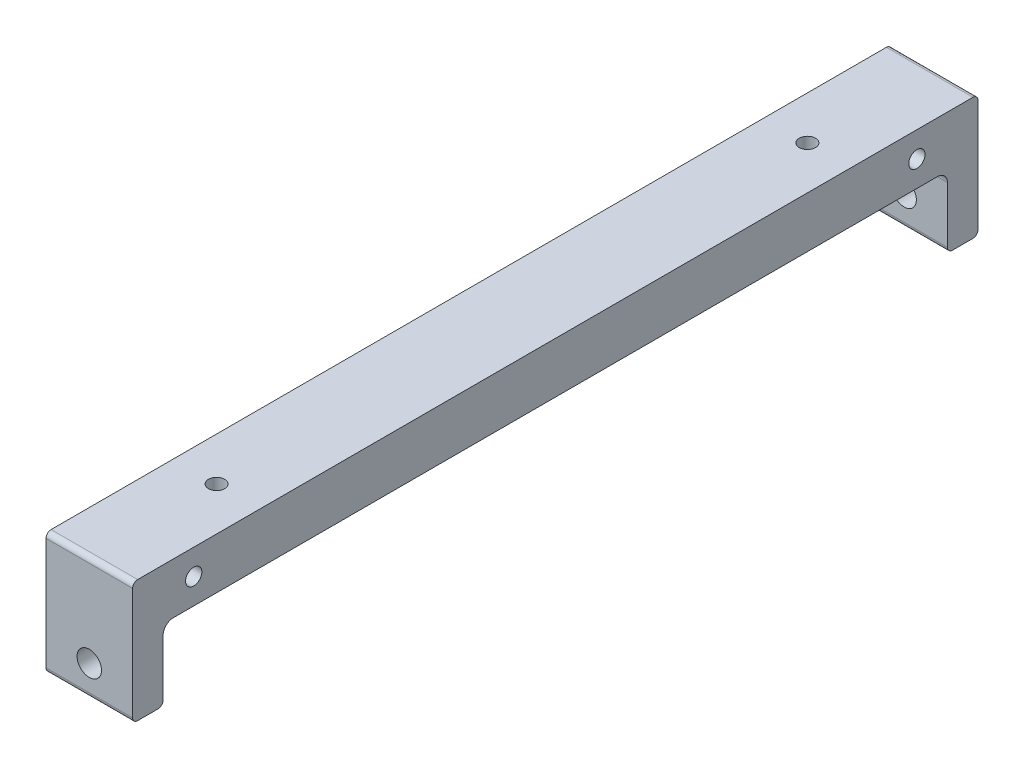
from build123d import *

# Parameters (mm, degrees)
SKETCH1_W           = 8.5
SKETCH1_H           = 12
BOSS_EXTRUDE1_DEPTH = 41.5
CUT_EXTRUDE1_DEPTH  = 43.784342931
FILLET1_R           = 0.5
M2_HOLE1_J_D        = 1.6
M2_HOLE1_J_DEPTH    = 5
M2_HOLE1_J_TIP      = 0.480688495
M2_HOLE2_K_D        = 1.6
M2_HOLE2_K_DEPTH    = 5
M2_HOLE2_K_TIP      = 0.480688495
M2_HOLE3_L_D        = 2.4
M2_HOLE3_L_DEPTH    = 10
M2_HOLE3_L_TIP      = 0.721032743
M2_HOLE4_M_D        = 1.6
M2_HOLE5_N_D        = 1.6
M2_HOLE5_N_DEPTH    = 4
M2_HOLE5_N_TIP      = 0.480688495
M2_HOLE6_P_D        = 2.4
M2_HOLE6_P_DEPTH    = 10
M2_HOLE6_P_TIP      = 0.721032743


with BuildPart() as part:
    # Sketch1 → Boss-Extrude1 (new, symmetric)
    with BuildSketch(Plane.XY):
        Rectangle(SKETCH1_W, SKETCH1_H)
    extrude(amount=BOSS_EXTRUDE1_DEPTH, both=True)

    # Sketch2 → Cut-Extrude1 (cut, through all)
    with BuildSketch(Plane(origin=(4.25, 0, 0), x_dir=(0, 0, -1), z_dir=(1, 0, 0))):
        with BuildLine():
            Line((-37.5, 1), (37.5, 1))
            ThreePointArc((37.5, 1), (38.207106781, 0.707106781), (38.5, 0))
            Line((38.5, 0), (38.5, -6))
            Line((38.5, -6), (-38.5, -6))
            Line((-38.5, -6), (-38.5, 0))
            ThreePointArc((-38.5, 0), (-38.207106781, 0.707106781), (-37.5, 1))
        make_face()
    extrude(amount=-CUT_EXTRUDE1_DEPTH, mode=Mode.SUBTRACT)

    # Fillet1
    fillet1_edges = [part.edges().sort_by_distance(p)[0] for p in [
        (0, -6, 41.5),
        (0, -6, -38.5),
        (0, -6, 38.5),
        (0, -6, -41.5),
        (0, 6, -41.5),
        (0, 6, 41.5),
    ]]
    fillet(fillet1_edges, radius=FILLET1_R)

    # M2 Hole1-J
    with Locations(Plane(origin=(4.25, 0, 0), x_dir=(0, 0, -1), z_dir=(1, 0, 0))):
        with Locations((-35.5, 3.5), (35.5, 3.5)):
            Hole(M2_HOLE1_J_D / 2, depth=M2_HOLE1_J_DEPTH)
            with Locations((0, 0, -(M2_HOLE1_J_DEPTH + M2_HOLE1_J_TIP / 2))):  # 118° drill point
                Cone(0, M2_HOLE1_J_D / 2, M2_HOLE1_J_TIP, mode=Mode.SUBTRACT)

    # M2 Hole2-K
    with Locations(Plane.ZY.offset(4.25)):
        with Locations((-21.5, 3.5), (21.5, 3.5)):
            Hole(M2_HOLE2_K_D / 2, depth=M2_HOLE2_K_DEPTH)
            with Locations((0, 0, -(M2_HOLE2_K_DEPTH + M2_HOLE2_K_TIP / 2))):  # 118° drill point
                Cone(0, M2_HOLE2_K_D / 2, M2_HOLE2_K_TIP, mode=Mode.SUBTRACT)

    # M2 Hole3-L
    with Locations(Plane.XY.offset(41.5)):
        with Locations((0, -3)):
            Hole(M2_HOLE3_L_D / 2, depth=M2_HOLE3_L_DEPTH)
            with Locations((0, 0, -(M2_HOLE3_L_DEPTH + M2_HOLE3_L_TIP / 2))):  # 118° drill point
                Cone(0, M2_HOLE3_L_D / 2, M2_HOLE3_L_TIP, mode=Mode.SUBTRACT)

    # M2 Hole4-M (through all)
    with Locations(Plane(origin=(0, 6, 0), x_dir=(1, 0, 0), z_dir=(0, 1, 0))):
        with Locations((0, 29), (0, -29)):
            Hole(M2_HOLE4_M_D / 2)

    # M2 Hole5-N
    with Locations(Plane.ZY.offset(4.25)):
        with Locations((0, 3.5)):
            Hole(M2_HOLE5_N_D / 2, depth=M2_HOLE5_N_DEPTH)
            with Locations((0, 0, -(M2_HOLE5_N_DEPTH + M2_HOLE5_N_TIP / 2))):  # 118° drill point
                Cone(0, M2_HOLE5_N_D / 2, M2_HOLE5_N_TIP, mode=Mode.SUBTRACT)

    # M2 Hole6-P
    with Locations(Plane(origin=(0, 0, -41.5), x_dir=(-1, 0, 0), z_dir=(0, 0, -1))):
        with Locations((0, -3)):
            Hole(M2_HOLE6_P_D / 2, depth=M2_HOLE6_P_DEPTH)
            with Locations((0, 0, -(M2_HOLE6_P_DEPTH + M2_HOLE6_P_TIP / 2))):  # 118° drill point
                Cone(0, M2_HOLE6_P_D / 2, M2_HOLE6_P_TIP, mode=Mode.SUBTRACT)


solid = part.part
